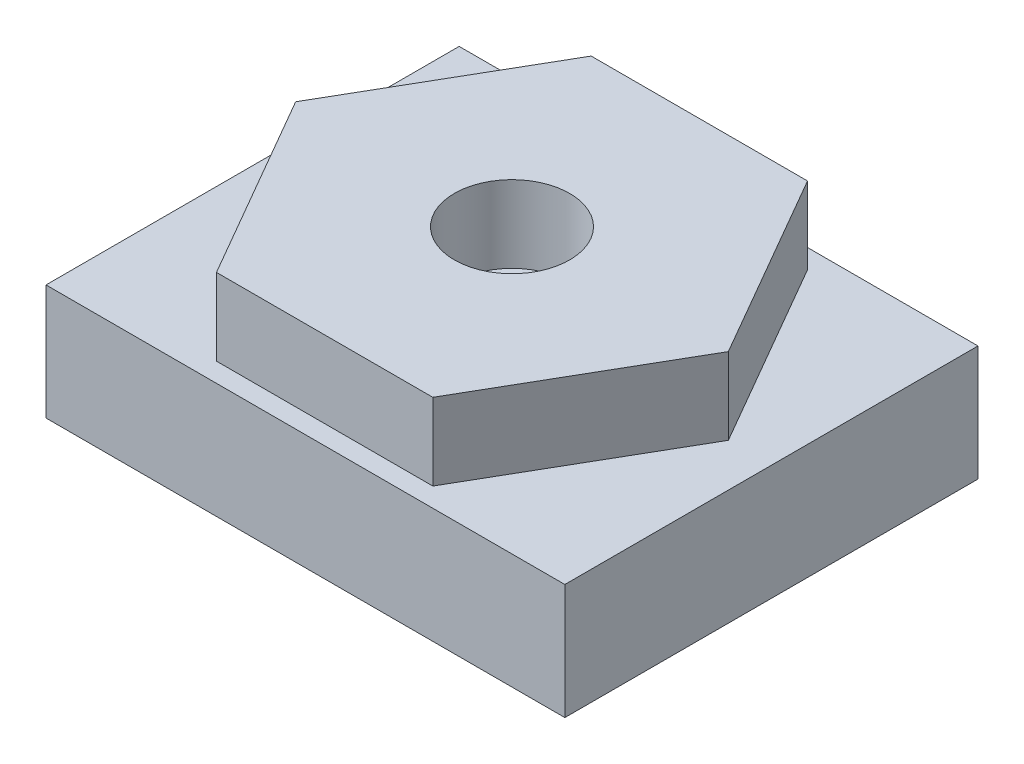
from build123d import *

# Parameters (mm, degrees)
SKETCH_1_W          = 54
SKETCH_1_H          = 43
EXTRUDE_1_DEPTH     = 12
SKETCH_2_R          = 1.55
EXTRUDE_2_DEPTH     = 8
SKETCH_4_R          = 6
CUT_EXTRUDE_2_DEPTH = 8


with BuildPart() as part:
    # 草图1 → 凸台-拉伸1 (new body)
    with BuildSketch(Plane(origin=(0, 0, 0), x_dir=(1, 0, 0), z_dir=(0, 1, 0))):
        Rectangle(SKETCH_1_W, SKETCH_1_H)
    extrude(amount=EXTRUDE_1_DEPTH)

    # 草图2 → 凸台-拉伸2 (add)
    with BuildSketch(Plane(origin=(0, 12, 0), x_dir=(1, 0, 0), z_dir=(0, 1, 0))):
        Polygon((-22.516660498, 0), (-11.258330249, -19.5), (11.258330249, -19.5), (22.516660498, 0), (11.258330249, 19.5), (-11.258330249, 19.5), align=None)
        with Locations(Location((0, 0, 0), (0, 0, 270))):
            Circle(SKETCH_2_R, mode=Mode.SUBTRACT)
    extrude(amount=EXTRUDE_2_DEPTH)

    # 草图4 → 切除-拉伸2 (cut)
    with BuildSketch(Plane(origin=(0, 20, 0), x_dir=(1, 0, 0), z_dir=(0, 1, 0))):
        with Locations(Location((0, 0, 0), (0, 0, 270))):
            Circle(SKETCH_4_R)
    extrude(amount=-CUT_EXTRUDE_2_DEPTH, mode=Mode.SUBTRACT)


solid = part.part
